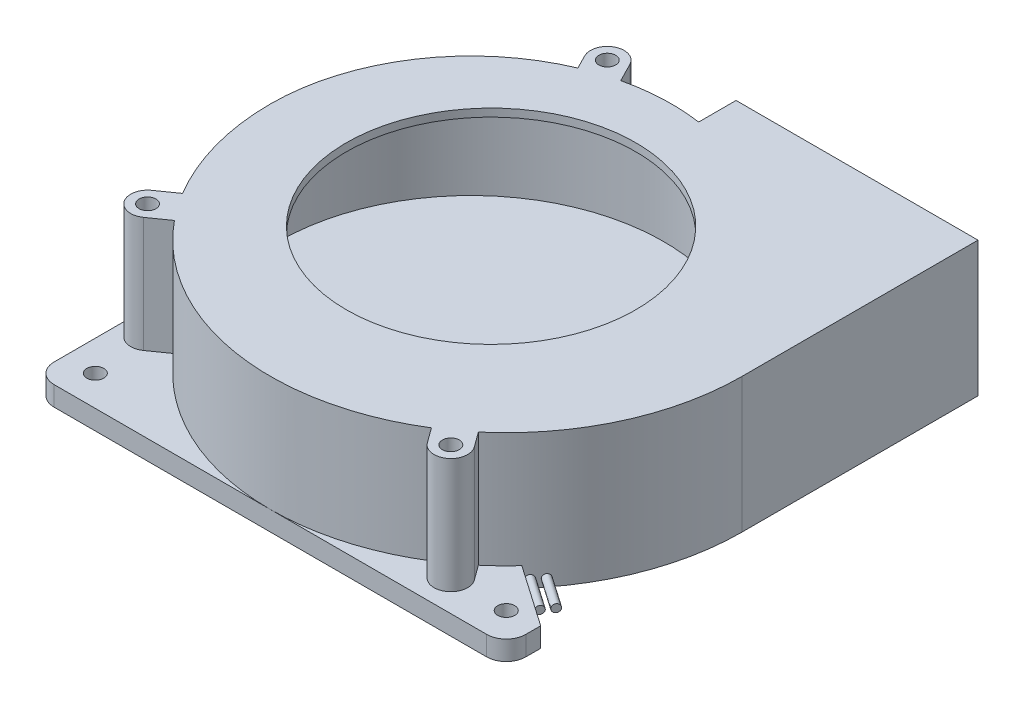
from build123d import *

# Parameters (mm, degrees)
ESBO_O1_W                = 120.6
ESBO_O1_H                = 120.6
RESSALTO_EXTRUS_O1_DEPTH = 5
ESBO_O2_R                = 2.16
ESBO_O2_R_2              = 37
RESSALTO_EXTRUS_O2_DEPTH = 29.48
CORTE_EXTRUS_O1_DEPTH    = 27.48
CORTE_EXTRUS_O2_REACH    = 92.229
ESBO_O4_R                = 2.175
CORTE_EXTRUS_O3_REACH    = 92.229
FILETE1_R                = 5
ESBO_O6_R                = 1
RESSALTO_EXTRUS_O3_DEPTH = 10


with BuildPart() as part:
    # Esboço1 → Ressalto-extrusão1 (new body)
    with BuildSketch(Plane(origin=(0, 0, 0), x_dir=(1, 0, 0), z_dir=(0, 1, 0))):
        Rectangle(ESBO_O1_W, ESBO_O1_H)
    extrude(amount=RESSALTO_EXTRUS_O1_DEPTH)

    # Esboço2 → Ressalto-extrusão2 (add)
    with BuildSketch(Plane(origin=(0, 5, 0), x_dir=(1, 0, 0), z_dir=(0, 1, 0))):
        with BuildLine():
            Line((-1.55, 60.3), (-1.55, 50.74))
            ThreePointArc((-1.55, 50.74), (-11.149709748, 51.241553514), (-20.674386419, 49.942893633))
            Line((-20.674386419, 49.942893633), (-23.114662996, 54.72290087))
            ThreePointArc((-23.114662996, 54.72290087), (-28.89290087, 56.595337004), (-30.765337004, 50.81709913))
            Line((-30.765337004, 50.81709913), (-28.946397101, 47.25416451))
            ThreePointArc((-28.946397101, 47.25416451), (-51.748686365, 28.3549135), (-60.3, 0))
            ThreePointArc((-60.3, 0), (-58.11119265, -16.099046207), (-51.703672015, -31.029345791))
            Line((-51.703672015, -31.029345791), (-56.356828802, -34.294067597))
            ThreePointArc((-56.356828802, -34.294067597), (-57.405932403, -40.276828802), (-51.423171198, -41.325932403))
            Line((-51.423171198, -41.325932403), (-46.77001441, -38.061210596))
            ThreePointArc((-46.77001441, -38.061210596), (-9.861567273, -59.488145802), (31.986619032, -51.116985464))
            Line((31.986619032, -51.116985464), (34.770606047, -54.931863068))
            ThreePointArc((34.770606047, -54.931863068), (40.771863068, -55.869393953), (41.709393953, -49.868136932))
            Line((41.709393953, -49.868136932), (38.925406938, -46.053259327))
            ThreePointArc((38.925406938, -46.053259327), (54.695941524, -25.385901221), (60.3, 0))
            Line((60.3, 0), (60.3, 60.3))
            Line((60.3, 60.3), (-1.55, 60.3))
        make_face()
        with Locations(Location((-53.89, -37.81, 0), (0, 0, 270))):
            Circle(ESBO_O2_R, mode=Mode.SUBTRACT)
        with Locations(Location((38.24, -52.4, 0), (0, 0, 270))):
            Circle(ESBO_O2_R, mode=Mode.SUBTRACT)
        with Locations(Location((-5.011670261, 1.136043404, 0), (0, 0, 270))):
            Circle(ESBO_O2_R_2, mode=Mode.SUBTRACT)
        with Locations(Location((-26.94, 52.77, 0), (0, 0, 270))):
            Circle(ESBO_O2_R, mode=Mode.SUBTRACT)
    extrude(amount=RESSALTO_EXTRUS_O2_DEPTH)

    # Esboço3 → Corte-extrusão1 (cut)
    with BuildSketch(Plane(origin=(0, 5, 0), x_dir=(1, 0, 0), z_dir=(0, 1, 0))):
        with BuildLine():
            Line((58.3, 60.3), (0.45, 60.3))
            Line((0.45, 60.3), (0.45, 48.368870154))
            ThreePointArc((0.45, 48.368870154), (-10.684091117, 49.257737718), (-21.732404969, 47.616752781))
            ThreePointArc((-21.732404969, 47.616752781), (-48.103316228, 30.018927995), (-58.3, 0))
            ThreePointArc((-58.3, 0), (-55.237005698, -18.64841016), (-46.369873019, -35.337301485))
            ThreePointArc((-46.369873019, -35.337301485), (-7.26299238, -57.845820434), (36.194519906, -45.703902774))
            ThreePointArc((36.194519906, -45.703902774), (52.483476021, -25.384537513), (58.3, 0))
            Line((58.3, 0), (58.3, 60.3))
        make_face()
    extrude(amount=CORTE_EXTRUS_O1_DEPTH, mode=Mode.SUBTRACT)

    # Esboço4 → Corte-extrusão2 (cut, up to next)
    with BuildSketch(Plane(origin=(0, 5, 0), x_dir=(1, 0, 0), z_dir=(0, 1, 0)), mode=Mode.PRIVATE) as corte_extrus_o2_sk1:
        with Locations(Location((-52.525, 52.525, 0), (0, 0, 270))):
            Circle(ESBO_O4_R)
    corte_extrus_o2_tool1 = extrude(corte_extrus_o2_sk1.sketch, amount=-CORTE_EXTRUS_O2_REACH, mode=Mode.PRIVATE) & part.part
    # Esboço4 → Corte-extrusão2 (cut, up to next)
    with BuildSketch(Plane(origin=(0, 5, 0), x_dir=(1, 0, 0), z_dir=(0, 1, 0)), mode=Mode.PRIVATE) as corte_extrus_o2_sk2:
        with Locations(Location((-52.525, -52.525, 0), (0, 0, 270))):
            Circle(ESBO_O4_R)
    corte_extrus_o2_tool2 = extrude(corte_extrus_o2_sk2.sketch, amount=-CORTE_EXTRUS_O2_REACH, mode=Mode.PRIVATE) & part.part
    # Esboço4 → Corte-extrusão2 (cut, up to next)
    with BuildSketch(Plane(origin=(0, 5, 0), x_dir=(1, 0, 0), z_dir=(0, 1, 0)), mode=Mode.PRIVATE) as corte_extrus_o2_sk3:
        with Locations(Location((52.525, -52.525, 0), (0, 0, 270))):
            Circle(ESBO_O4_R)
    corte_extrus_o2_tool3 = extrude(corte_extrus_o2_sk3.sketch, amount=-CORTE_EXTRUS_O2_REACH, mode=Mode.PRIVATE) & part.part
    add(corte_extrus_o2_tool1.solids().sort_by_distance((-52.525, 5, -52.525))[0], mode=Mode.SUBTRACT)
    add(corte_extrus_o2_tool2.solids().sort_by_distance((-52.525, 5, 52.525))[0], mode=Mode.SUBTRACT)
    add(corte_extrus_o2_tool3.solids().sort_by_distance((52.525, 5, 52.525))[0], mode=Mode.SUBTRACT)

    # Esboço5 → Corte-extrusão3 (cut, up to next)
    with BuildSketch(Plane(origin=(0, 5, 0), x_dir=(1, 0, 0), z_dir=(0, 1, 0)), mode=Mode.PRIVATE) as corte_extrus_o3_sk1:
        with BuildLine():
            Line((44.583965728, -40.6), (60.3, -51.5))
            Line((60.3, -51.5), (60.3, 0))
            ThreePointArc((60.3, 0), (56.233900511, -21.767830239), (44.583965728, -40.6))
        make_face()
    corte_extrus_o3_tool1 = extrude(corte_extrus_o3_sk1.sketch, amount=-CORTE_EXTRUS_O3_REACH, mode=Mode.PRIVATE) & part.part
    add(corte_extrus_o3_tool1.solids().sort_by_distance((55.517815, 5, 34.778599))[0], mode=Mode.SUBTRACT)

    # Filete1
    filete1_edges = [part.edges().sort_by_distance(p)[0] for p in [
        (-60.3, 2.5, -60.3),
        (60.3, 2.5, 60.3),
        (-60.3, 2.5, 60.3),
    ]]
    fillet(filete1_edges, radius=FILETE1_R)

    # Esboço6 → Ressalto-extrusão3 (add)
    with BuildSketch(Plane(origin=(49.116321983, 0, 34.065076491), x_dir=(0, 1, 0), z_dir=(-0.8217106210842787, 1.9312545644066756e-15, -0.5699049527748369))):
        with Locations(Location((1.975912972, -6.452828334, 0), (0, 0, 270))):
            Circle(ESBO_O6_R)
        with Locations(Location((1.975912972, -3.452828334, 0), (0, 0, 270))):
            Circle(ESBO_O6_R)
    extrude(amount=-RESSALTO_EXTRUS_O3_DEPTH)


solid = part.part
